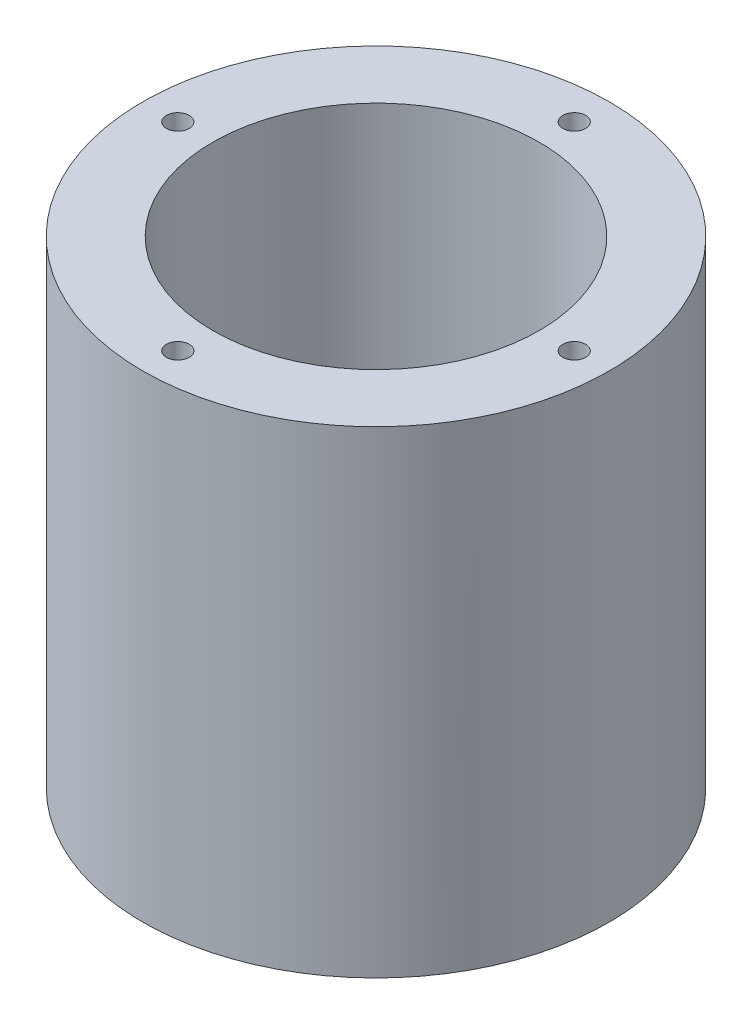
from build123d import *

# Parameters (mm, degrees)
SKETCH1_R           = 31.75
SKETCH1_R_2         = 22.225
BOSS_EXTRUDE1_DEPTH = 55
BOSS_EXTRUDE2_START = 10
SKETCH2_R           = 31.75
BOSS_EXTRUDE2_DEPTH = 10
SKETCH3_R           = 1.55
CUT_EXTRUDE1_DEPTH  = 5
SKETCH7_R           = 3
CUT_EXTRUDE2_DEPTH  = 10


with BuildPart() as part:
    # Sketch1 → Boss-Extrude1 (new body)
    with BuildSketch(Plane(origin=(0, 0, 0), x_dir=(1, 0, 0), z_dir=(0, 1, 0))):
        with Locations(Location((0, 0, 0), (0, 0, 270))):
            Circle(SKETCH1_R)
        with Locations(Location((0, 0, 0), (0, 0, 270))):
            Circle(SKETCH1_R_2, mode=Mode.SUBTRACT)
    extrude(amount=BOSS_EXTRUDE1_DEPTH)

    # Sketch2 → Boss-Extrude2 (add)
    with BuildSketch(Plane.XZ.offset(BOSS_EXTRUDE2_START)):
        with Locations(Location((0, 0, 0), (0, 0, 270))):
            Circle(SKETCH2_R)
    extrude(amount=-BOSS_EXTRUDE2_DEPTH)

    # Sketch3 → Cut-Extrude1 (cut)
    with BuildSketch(Plane(origin=(0, 55, 0), x_dir=(1, 0, 0), z_dir=(0, 1, 0))):
        with Locations(Location((0, 26.9875, 0), (0, 0, 270))):
            Circle(SKETCH3_R)
        with Locations(Location((26.9875, 0, 0), (0, 0, 270))):
            Circle(SKETCH3_R)
        with Locations(Location((0, -26.9875, 0), (0, 0, 270))):
            Circle(SKETCH3_R)
        with Locations(Location((-26.9875, 0, 0), (0, 0, 270))):
            Circle(SKETCH3_R)
    extrude(amount=-CUT_EXTRUDE1_DEPTH, mode=Mode.SUBTRACT)

    # Sketch7 → Cut-Extrude2 (cut)
    with BuildSketch(Plane(origin=(0, -10, 0), x_dir=(-1, 0, 0), z_dir=(0, -1, 0))):
        with Locations(Location((19.05, 0, 0), (0, 0, 90))):
            Circle(SKETCH7_R)
        with Locations(Location((-19.05, 0, 0), (0, 0, 90))):
            Circle(SKETCH7_R)
    extrude(amount=-CUT_EXTRUDE2_DEPTH, mode=Mode.SUBTRACT)


solid = part.part
